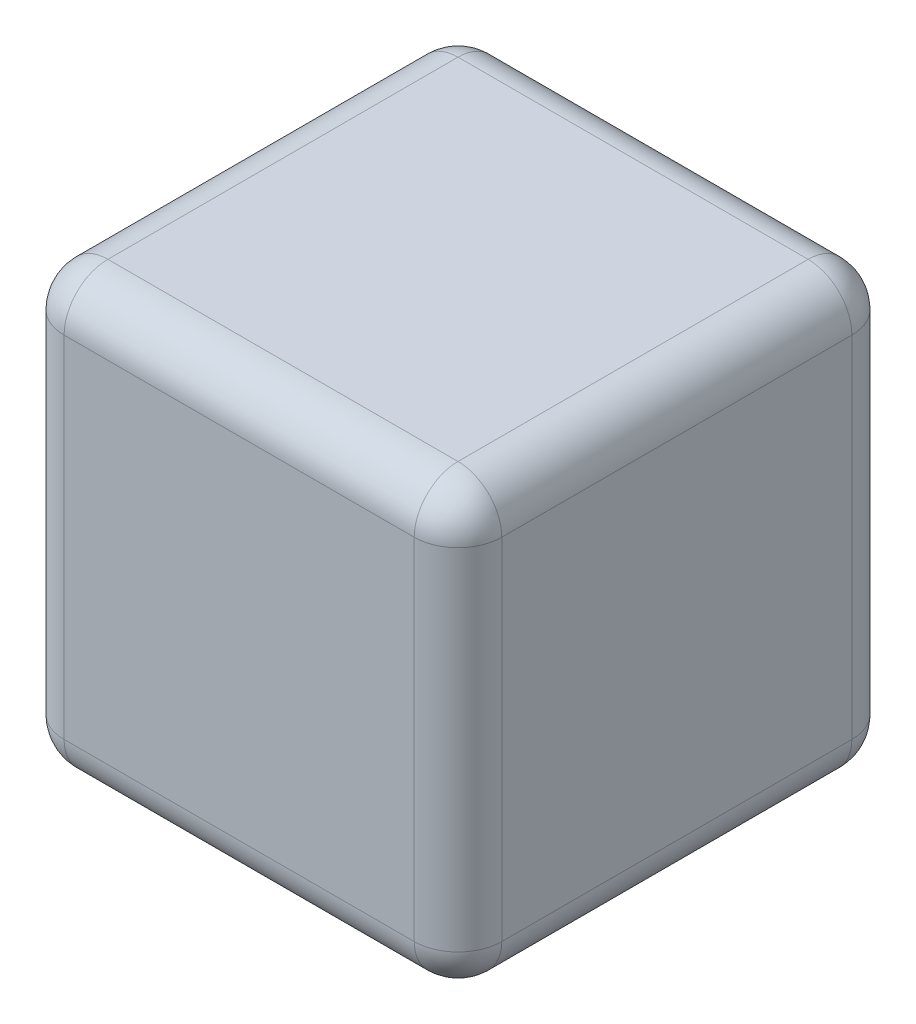
from build123d import *

# Parameters (mm, degrees)
SKETCH1_W           = 63.5
SKETCH1_H           = 63.5
BOSS_EXTRUDE1_DEPTH = 63.5
FILLET1_R           = 6.35


with BuildPart() as part:
    # Sketch1 → Boss-Extrude1 (new body)
    with BuildSketch(Plane(origin=(0, 0, 0), x_dir=(1, 0, 0), z_dir=(0, 1, 0))):
        with Locations((31.75, -31.75)):
            Rectangle(SKETCH1_W, SKETCH1_H)
    extrude(amount=BOSS_EXTRUDE1_DEPTH)

    # Fillet1
    fillet1_edges = [part.edges().sort_by_distance(p)[0] for p in [
        (63.5, 63.5, 31.75),
        (31.75, 63.5, 0),
        (0, 63.5, 31.75),
        (31.75, 0, 0),
        (63.5, 0, 31.75),
        (31.75, 0, 63.5),
        (0, 0, 31.75),
        (0, 31.75, 0),
        (63.5, 31.75, 0),
        (63.5, 31.75, 63.5),
        (0, 31.75, 63.5),
        (31.75, 63.5, 63.5),
    ]]
    fillet(fillet1_edges, radius=FILLET1_R)


solid = part.part
